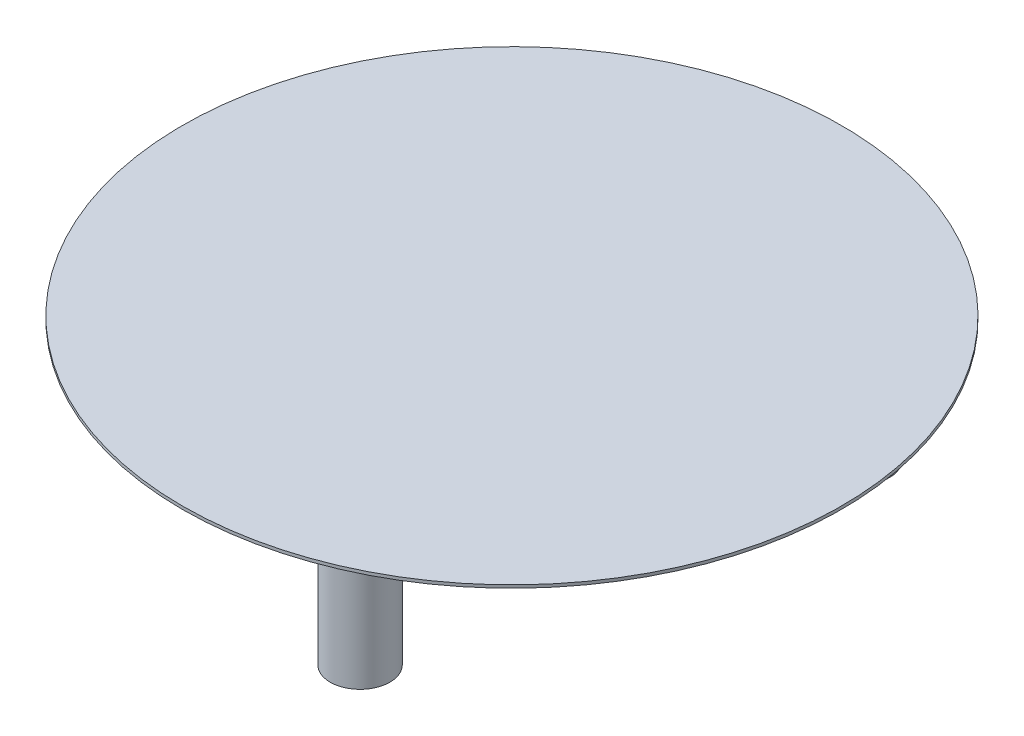
from build123d import *

# Parameters (mm, degrees)
SKETCH1_R           = 43.815
BOSS_EXTRUDE1_DEPTH = 0.396875
SKETCH2_R           = 3.96875
BOSS_EXTRUDE2_DEPTH = 19.05


with BuildPart() as part:
    # Sketch1 → Boss-Extrude1 (new body)
    with BuildSketch(Plane(origin=(0, 0, 0), x_dir=(1, 0, 0), z_dir=(0, 1, 0))):
        with Locations(Location((0, 0, 0), (0, 0, 270))):
            Circle(SKETCH1_R)
    extrude(amount=BOSS_EXTRUDE1_DEPTH)

    # Sketch2 → Boss-Extrude2 (add)
    with BuildSketch(Plane.XZ):
        with Locations(Location((20.32, -25.908, 0), (0, 0, 90))):
            Circle(SKETCH2_R)
        with Locations(Location((-25.908, -19.939, 0), (0, 0, 90))):
            Circle(SKETCH2_R)
        with Locations(Location((10.668, 30.861, 0), (0, 0, 90))):
            Circle(SKETCH2_R)
    extrude(amount=BOSS_EXTRUDE2_DEPTH)


solid = part.part
